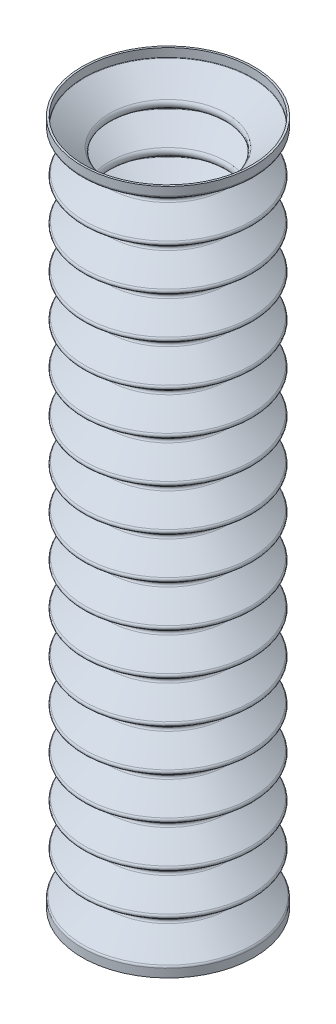
from build123d import *

# Parameters (mm, degrees)
SHELL1_T = -1.1938


with BuildPart() as part:
    # Sketch1 → Revolve2 (revolve)
    with BuildSketch(Plane.XY):
        with BuildLine():
            Line((0, 0), (0, 422))
            Line((0, 422), (52.959, 422))
            Line((52.959, 422), (52.959, 416.814432914))
            ThreePointArc((52.959, 416.814432914), (52.790397037, 416.117672645), (52.321893868, 415.575080153))
            Line((52.321893868, 415.575080153), (36.783881707, 404.455915261))
            ThreePointArc((36.783881707, 404.455915261), (36.146775575, 403.2165625), (36.783881707, 401.977209739))
            Line((36.783881707, 401.977209739), (51.227118293, 391.641477761))
            ThreePointArc((51.227118293, 391.641477761), (51.864224425, 390.402125), (51.227118293, 389.162772239))
            Line((51.227118293, 389.162772239), (36.783881707, 378.827040261))
            ThreePointArc((36.783881707, 378.827040261), (36.146775575, 377.5876875), (36.783881707, 376.348334739))
            Line((36.783881707, 376.348334739), (51.227118293, 366.012602761))
            ThreePointArc((51.227118293, 366.012602761), (51.864224425, 364.77325), (51.227118293, 363.533897239))
            Line((51.227118293, 363.533897239), (36.783881707, 353.198165261))
            ThreePointArc((36.783881707, 353.198165261), (36.146775575, 351.9588125), (36.783881707, 350.719459739))
            Line((36.783881707, 350.719459739), (51.227118293, 340.383727761))
            ThreePointArc((51.227118293, 340.383727761), (51.864224425, 339.144375), (51.227118293, 337.905022239))
            Line((51.227118293, 337.905022239), (36.783881707, 327.569290261))
            ThreePointArc((36.783881707, 327.569290261), (36.146775575, 326.3299375), (36.783881707, 325.090584739))
            Line((36.783881707, 325.090584739), (51.227118293, 314.754852761))
            ThreePointArc((51.227118293, 314.754852761), (51.864224425, 313.5155), (51.227118293, 312.276147239))
            Line((51.227118293, 312.276147239), (36.783881707, 301.940415261))
            ThreePointArc((36.783881707, 301.940415261), (36.146775575, 300.7010625), (36.783881707, 299.461709739))
            Line((36.783881707, 299.461709739), (51.227118293, 289.125977761))
            ThreePointArc((51.227118293, 289.125977761), (51.864224425, 287.886625), (51.227118293, 286.647272239))
            Line((51.227118293, 286.647272239), (36.783881707, 276.311540261))
            ThreePointArc((36.783881707, 276.311540261), (36.146775575, 275.0721875), (36.783881707, 273.832834739))
            Line((36.783881707, 273.832834739), (51.227118293, 263.497102761))
            ThreePointArc((51.227118293, 263.497102761), (51.864224425, 262.25775), (51.227118293, 261.018397239))
            Line((51.227118293, 261.018397239), (36.783881707, 250.682665261))
            ThreePointArc((36.783881707, 250.682665261), (36.146775575, 249.4433125), (36.783881707, 248.203959739))
            Line((36.783881707, 248.203959739), (51.227118293, 237.868227761))
            ThreePointArc((51.227118293, 237.868227761), (51.864224425, 236.628875), (51.227118293, 235.389522239))
            Line((51.227118293, 235.389522239), (36.783881707, 225.053790261))
            ThreePointArc((36.783881707, 225.053790261), (36.146775575, 223.8144375), (36.783881707, 222.575084739))
            Line((36.783881707, 222.575084739), (51.227118293, 212.239352761))
            ThreePointArc((51.227118293, 212.239352761), (51.864224425, 211), (51.227118293, 209.760647239))
            Line((51.227118293, 209.760647239), (36.783881707, 199.424915261))
            ThreePointArc((36.783881707, 199.424915261), (36.146775575, 198.1855625), (36.783881707, 196.946209739))
            Line((36.783881707, 196.946209739), (51.227118293, 186.610477761))
            ThreePointArc((51.227118293, 186.610477761), (51.864224425, 185.371125), (51.227118293, 184.131772239))
            Line((51.227118293, 184.131772239), (36.783881707, 173.796040261))
            ThreePointArc((36.783881707, 173.796040261), (36.146775575, 172.5566875), (36.783881707, 171.317334739))
            Line((36.783881707, 171.317334739), (51.227118293, 160.981602761))
            ThreePointArc((51.227118293, 160.981602761), (51.864224425, 159.74225), (51.227118293, 158.502897239))
            Line((51.227118293, 158.502897239), (36.783881707, 148.167165261))
            ThreePointArc((36.783881707, 148.167165261), (36.146775575, 146.9278125), (36.783881707, 145.688459739))
            Line((36.783881707, 145.688459739), (51.227118293, 135.352727761))
            ThreePointArc((51.227118293, 135.352727761), (51.864224425, 134.113375), (51.227118293, 132.874022239))
            Line((51.227118293, 132.874022239), (36.783881707, 122.538290261))
            ThreePointArc((36.783881707, 122.538290261), (36.146775575, 121.2989375), (36.783881707, 120.059584739))
            Line((36.783881707, 120.059584739), (51.227118293, 109.723852761))
            ThreePointArc((51.227118293, 109.723852761), (51.864224425, 108.4845), (51.227118293, 107.245147239))
            Line((51.227118293, 107.245147239), (36.783881707, 96.909415261))
            ThreePointArc((36.783881707, 96.909415261), (36.146775575, 95.6700625), (36.783881707, 94.430709739))
            Line((36.783881707, 94.430709739), (51.227118293, 84.094977761))
            ThreePointArc((51.227118293, 84.094977761), (51.864224425, 82.855625), (51.227118293, 81.616272239))
            Line((51.227118293, 81.616272239), (36.783881707, 71.280540261))
            ThreePointArc((36.783881707, 71.280540261), (36.146775575, 70.0411875), (36.783881707, 68.801834739))
            Line((36.783881707, 68.801834739), (51.227118293, 58.466102761))
            ThreePointArc((51.227118293, 58.466102761), (51.864224425, 57.22675), (51.227118293, 55.987397239))
            Line((51.227118293, 55.987397239), (36.783881707, 45.651665261))
            ThreePointArc((36.783881707, 45.651665261), (36.146775575, 44.4123125), (36.783881707, 43.172959739))
            Line((36.783881707, 43.172959739), (51.227118293, 32.837227761))
            ThreePointArc((51.227118293, 32.837227761), (51.864224425, 31.597875), (51.227118293, 30.358522239))
            Line((51.227118293, 30.358522239), (36.783881707, 20.022790261))
            ThreePointArc((36.783881707, 20.022790261), (36.146775575, 18.7834375), (36.783881707, 17.544084739))
            Line((36.783881707, 17.544084739), (52.321893868, 6.424919847))
            ThreePointArc((52.321893868, 6.424919847), (52.790397037, 5.882327355), (52.959, 5.185567086))
            Line((52.959, 5.185567086), (52.959, 0))
            Line((52.959, 0), (0, 0))
        make_face()
    revolve(axis=Axis((0, 0, 0), (0, 1, 0)))

    # Shell1
    shell1_openings = [part.faces().sort_by_distance(p)[0] for p in [
        (0, 0, 0),
        (0, 422, 0),
    ]]
    offset(amount=SHELL1_T, openings=shell1_openings, kind=Kind.INTERSECTION)


solid = part.part
